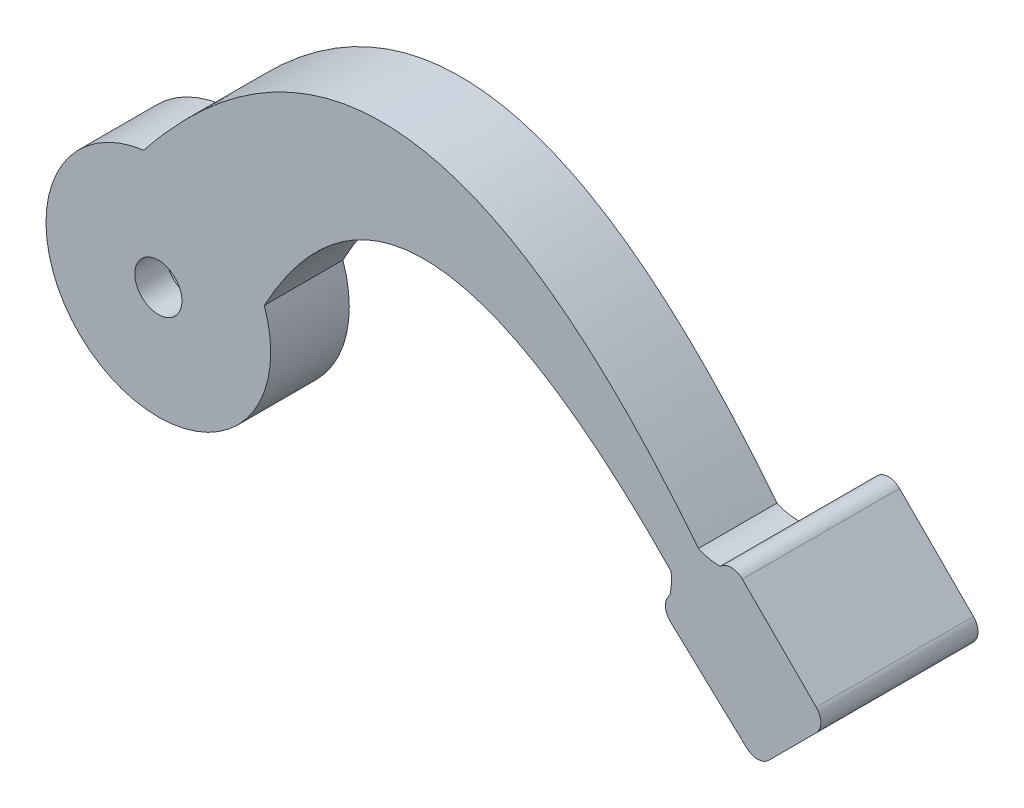
from build123d import *

# Parameters (mm, degrees)
ESQUISSE1_R             = 7.15
ESQUISSE1_R_2           = 3.15
BOSS_EXTRU_1_DEPTH      = 5
BOSS_EXTRU_2_DEPTH      = 5
BOSS_EXTRU_3_START      = -2
ESQUISSE3_R             = 3.15
ESQUISSE3_R_2           = 1.5
BOSS_EXTRU_3_DEPTH      = 2
BOSS_EXTRU_5_DEPTH      = 10
ENL_V_MAT_EXTRU_1_DEPTH = 5


with BuildPart() as part:
    # Esquisse1 → Boss.-Extru.1 (new body)
    with BuildSketch(Plane.XY):
        Circle(ESQUISSE1_R)
        Circle(ESQUISSE1_R_2, mode=Mode.SUBTRACT)
    extrude(amount=BOSS_EXTRU_1_DEPTH)

    # Esquisse2 → Boss.-Extru.2 (add)
    with BuildSketch(Plane.XY.offset(5)):
        with BuildLine():
            Line((-0.926838299, 7.08967353), (6.743880262, 2.375411335))
            add(Edge.make_bspline(
                [(34.021054956, -0.824268448), (15.778325112, 19.117081856), (6.743880262, 2.375411335)],
                knots=[0, 0, 0, 1, 1, 1], degree=2))
            add(Edge.make_bspline(
                [(35.905224024, 0.760247249), (37.183183912, -2.67189548), (34.021054956, -0.824268448)],
                knots=[0, 0, 0, 1, 1, 1], degree=2))
            add(Edge.make_bspline(
                [(-0.926838299, 7.08967353), (15.737638427, 28.114370549), (35.905224024, 0.760247249)],
                knots=[0, 0, 0, 1, 1, 1], degree=2))
        make_face()
    extrude(amount=-BOSS_EXTRU_2_DEPTH)

    # Esquisse3 → Boss.-Extru.3 (add)
    with BuildSketch(Plane.XY.offset(5).offset(BOSS_EXTRU_3_START)):
        Circle(ESQUISSE3_R)
        Circle(ESQUISSE3_R_2, mode=Mode.SUBTRACT)
    extrude(amount=BOSS_EXTRU_3_DEPTH)

    # Esquisse6 → Boss.-Extru.5 (add)
    with BuildSketch(Plane.XY.offset(5)):
        with BuildLine():
            Line((37.162166163, 2.495785683), (41.863791518, -2.205839672))
            ThreePointArc((41.863791518, -2.205839672), (42.156684737, -2.912946454), (41.863791518, -3.620053235))
            Line((41.863791518, -3.620053235), (38.837480033, -6.646364721))
            ThreePointArc((38.837480033, -6.646364721), (38.148081452, -6.939101137), (37.448749191, -6.670960502))
            Line((37.448749191, -6.670960502), (32.580530811, -2.135928171))
            ThreePointArc((32.580530811, -2.135928171), (32.262311674, -1.421933809), (32.55504809, -0.697118827))
            add(Edge.make_bspline(
                [(32.55504809, -0.697118827), (33.011349081, 1.483281056), (31.368103593, 3.24060207)],
                knots=[0, 0, 0, 1, 1, 1], degree=2))
            Line((31.368103593, 3.24060207), (32.92139501, 4.017247779))
            add(Edge.make_bspline(
                [(35.7479526, 2.495785683), (33.974850615, 2.525051405), (32.92139501, 4.017247779)],
                knots=[0, 0, 0, 1, 1, 1], degree=2))
            ThreePointArc((35.7479526, 2.495785683), (36.455059382, 2.788678902), (37.162166163, 2.495785683))
        make_face()
    extrude(amount=-BOSS_EXTRU_5_DEPTH)

    # Esquisse7 → Enlèv. mat.-Extru.1 (cut)
    with BuildSketch(Plane(origin=(0, 0, -5), x_dir=(-1, 0, 0), z_dir=(0, 0, -1))):
        Polygon((-35.7479526, 2.495785683), (-32.55504809, -0.697118827), (-29.617226271, 2.240702992), (-34.427657246, 5.5904913), align=None)
    extrude(amount=-ENL_V_MAT_EXTRU_1_DEPTH, mode=Mode.SUBTRACT)


solid = part.part
